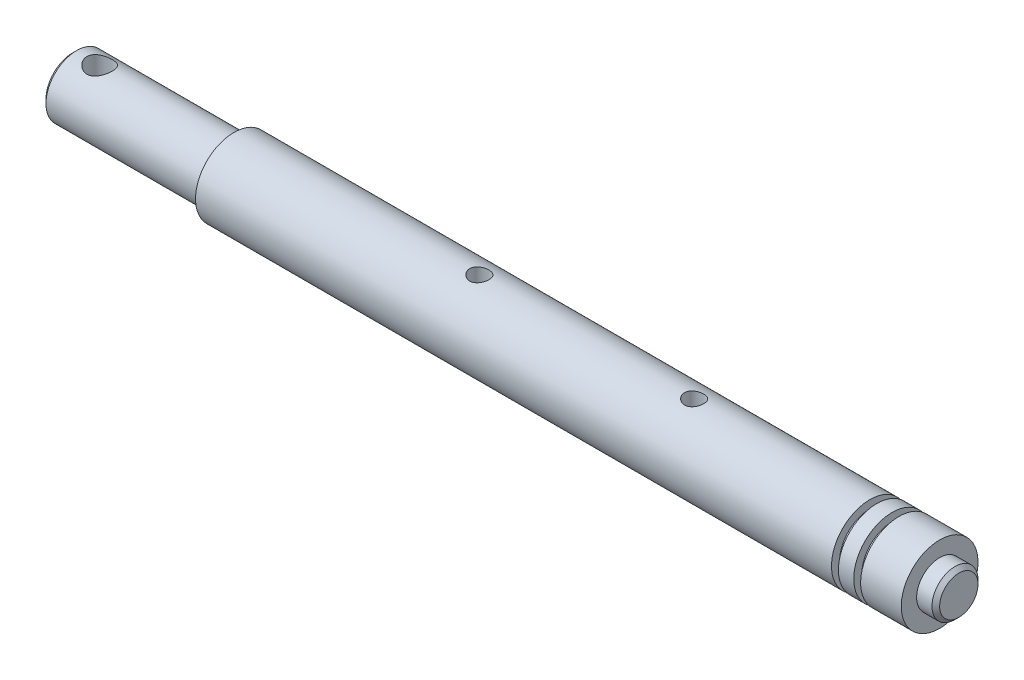
from build123d import *

# Parameters (mm, degrees)
SKETCH_1_R          = 4
EXTRUDE_1_DEPTH     = 21
SKETCH_2_R          = 5
EXTRUDE_2_DEPTH     = 92
SKETCH_3_R          = 1.65
CUT_EXTRUDE_1_DEPTH = 20
CUT_EXTRUDE_START   = -5.3
SKETCH_7_R          = 5
SKETCH_7_R_2        = 3.95
CUT_EXTRUDE_4_DEPTH = 0.9
SKETCH_8_R          = 3
EXTRUDE_3_DEPTH     = 2.5
CHAMFER_1_SIZE      = 0.5
SKETCH_9_R          = 1.25
CUT_EXTRUDE_5_DEPTH = 7
CUT_EXTRUDE_START_2 = -3.3
SKETCH_7_2_R        = 5
SKETCH_7_2_R_2      = 3.95
CUT_EXTRUDE_6_DEPTH = 0.9


with BuildPart() as part:
    # 草图1 → 凸台-拉伸1 (new body)
    with BuildSketch(Plane(origin=(0, 0, 0), x_dir=(0, 0, -1), z_dir=(1, 0, 0))):
        with Locations(Location((0, 0, 0), (0, 0, 180))):
            Circle(SKETCH_1_R)
    extrude(amount=EXTRUDE_1_DEPTH)

    # 草图2 → 凸台-拉伸2 (add)
    with BuildSketch(Plane(origin=(21, 0, 0), x_dir=(0, 0, -1), z_dir=(1, 0, 0))):
        with Locations(Location((0, 0, 0), (0, 0, 270))):
            Circle(SKETCH_2_R)
    extrude(amount=EXTRUDE_2_DEPTH)

    # 草图3 → 切除-拉伸1 (cut)
    with BuildSketch(Plane(origin=(0, 7, 0), x_dir=(1, 0, 0), z_dir=(0, 1, 0))):
        with Locations(Location((3.5, 0, 0), (0, 0, 270))):
            Circle(SKETCH_3_R)
    extrude(amount=-CUT_EXTRUDE_1_DEPTH, mode=Mode.SUBTRACT)

    # 草图7 → 切除-拉伸4 (cut)
    with BuildSketch(Plane.ZY.offset(-101.5).offset(CUT_EXTRUDE_START)):
        with Locations(Location((0, 0, 0), (0, 0, 180))):
            Circle(SKETCH_7_R)
        with Locations(Location((0, 0, 0), (0, 0, 180))):
            Circle(SKETCH_7_R_2, mode=Mode.SUBTRACT)
    extrude(amount=-CUT_EXTRUDE_4_DEPTH, mode=Mode.SUBTRACT)

    # 草图8 → 凸台-拉伸3 (add)
    with BuildSketch(Plane(origin=(113, 0, 0), x_dir=(0, 0, -1), z_dir=(1, 0, 0))):
        Circle(SKETCH_8_R)
    extrude(amount=EXTRUDE_3_DEPTH)

    # 倒角1
    chamfer_1_edges = [part.edges().sort_by_distance(p)[0] for p in [
        (0, 0, -4),
        (115.5, 0, 3),
    ]]
    chamfer(chamfer_1_edges, length=CHAMFER_1_SIZE)

    # 草图9 → 切除-拉伸5 (cut)
    with BuildSketch(Plane(origin=(0, 5, 0), x_dir=(1, 0, 0), z_dir=(0, 1, 0))):
        with Locations(Location((81, 0, 0), (0, 0, 270))):
            Circle(SKETCH_9_R)
        with Locations(Location((53, 0, 0), (0, 0, 270))):
            Circle(SKETCH_9_R)
    extrude(amount=-CUT_EXTRUDE_5_DEPTH, mode=Mode.SUBTRACT)

    # 草图7<2> → 切除-拉伸6 (cut)
    with BuildSketch(Plane.ZY.offset(-101.5).offset(CUT_EXTRUDE_START_2)):
        with Locations(Location((0, 0, 0), (0, 0, 180))):
            Circle(SKETCH_7_2_R)
        with Locations(Location((0, 0, 0), (0, 0, 180))):
            Circle(SKETCH_7_2_R_2, mode=Mode.SUBTRACT)
    extrude(amount=CUT_EXTRUDE_6_DEPTH, mode=Mode.SUBTRACT)


solid = part.part
